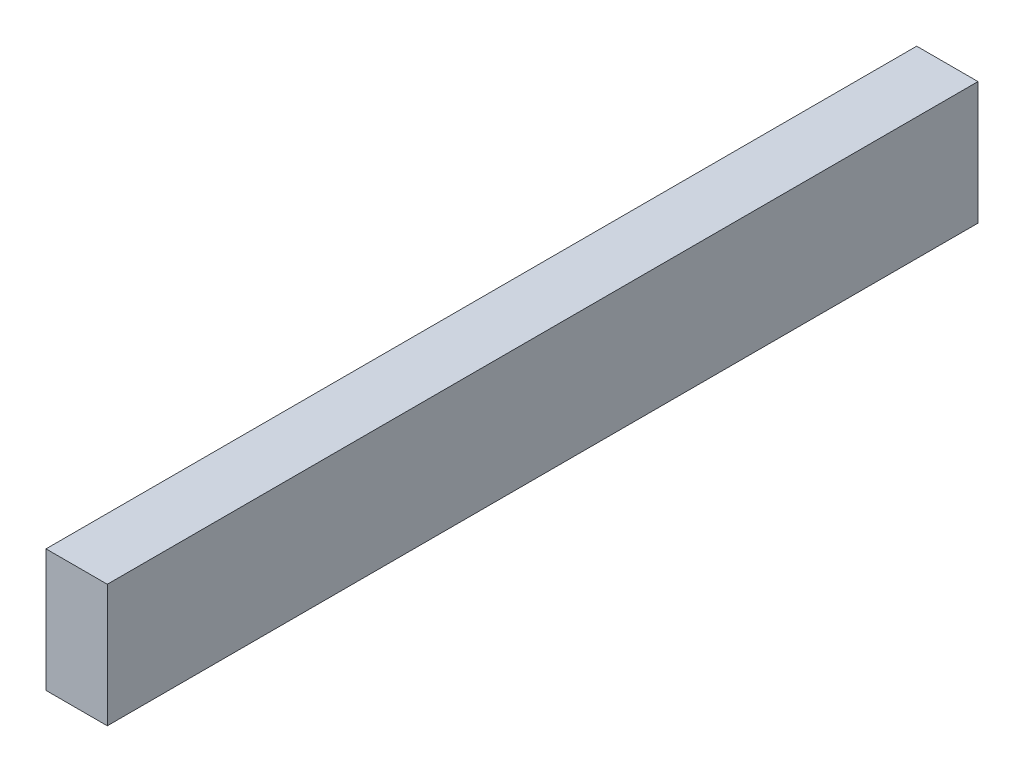
from build123d import *

# Parameters (mm, degrees)
SKETCH2_W           = 50.8
SKETCH2_H           = 101.6
BOSS_EXTRUDE1_DEPTH = 721.45


with BuildPart() as part:
    # Sketch2 → Boss-Extrude1 (new body)
    with BuildSketch(Plane.XY):
        with Locations((25.4, 50.8)):
            Rectangle(SKETCH2_W, SKETCH2_H)
    extrude(amount=BOSS_EXTRUDE1_DEPTH)


solid = part.part
